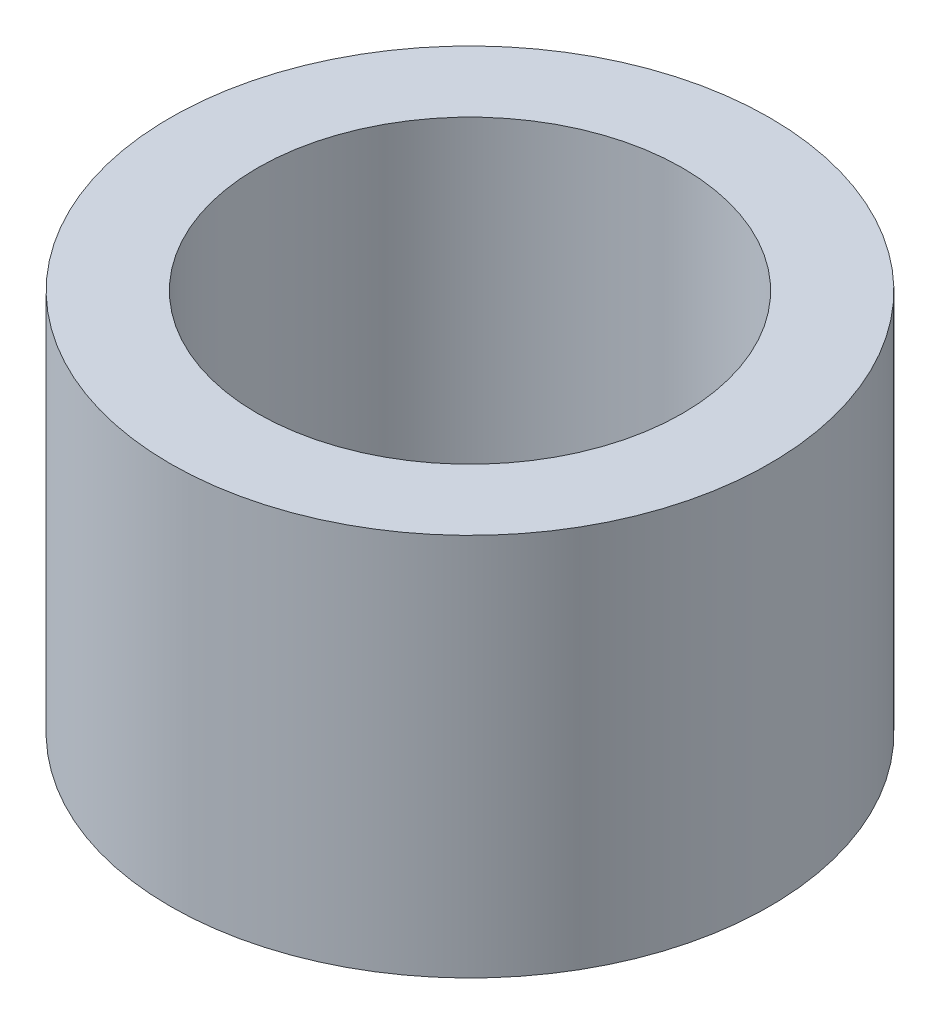
from build123d import *

# Parameters (mm, degrees)
SKETCH2_R           = 8.6
SKETCH2_R_2         = 6.1
BOSS_EXTRUDE1_DEPTH = 11


with BuildPart() as part:
    # Sketch2 → Boss-Extrude1 (new body)
    with BuildSketch(Plane(origin=(0, 0, 0), x_dir=(1, 0, 0), z_dir=(0, 1, 0))):
        with Locations(Location((0, 0, 0), (0, 0, 270))):
            Circle(SKETCH2_R)
        with Locations(Location((0, 0, 0), (0, 0, 270))):
            Circle(SKETCH2_R_2, mode=Mode.SUBTRACT)
    extrude(amount=BOSS_EXTRUDE1_DEPTH)


solid = part.part
